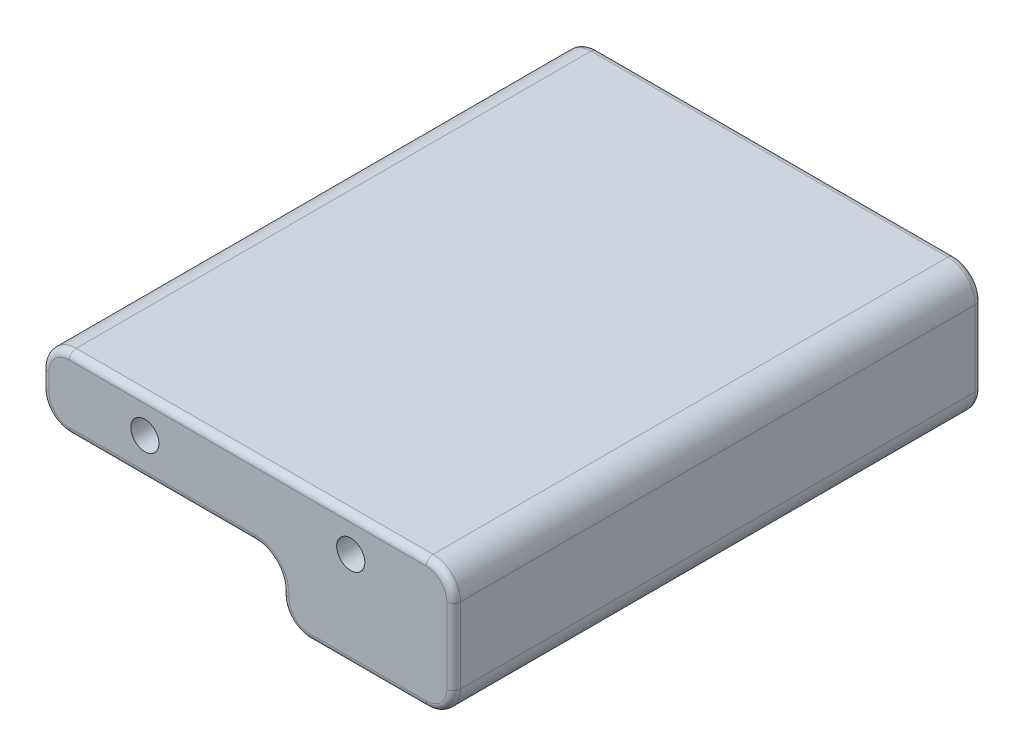
from build123d import *

# Parameters (mm, degrees)
SKETCH_1_W          = 60
SKETCH_1_H          = 10.5
SKETCH_1_R          = 1.55
EXTRUDE_1_DEPTH     = 77
SKETCH_2_W          = 25
SKETCH_2_H          = 77
EXTRUDE_2_DEPTH     = 8.5
FILLET_2_R          = 4
SKETCH_3_R          = 1.55
CUT_EXTRUDE_1_DEPTH = 8
SKETCH_4_R          = 2.05
CUT_EXTRUDE_2_DEPTH = 5
CUT_EXTRUDE_START   = -5
SKETCH_5_R          = 2.05
CUT_EXTRUDE_3_DEPTH = 5
FILLET_3_R          = 1
SKETCH_6_R          = 2.05
CUT_EXTRUDE_4_DEPTH = 5


with BuildPart() as part:
    # 草图1 → 凸台-拉伸1 (new body)
    with BuildSketch(Plane.XY):
        with Locations((30, 5.25)):
            Rectangle(SKETCH_1_W, SKETCH_1_H)
        with Locations((15, 5.5)):
            Circle(SKETCH_1_R, mode=Mode.SUBTRACT)
        with Locations((45, 5.5)):
            Circle(SKETCH_1_R, mode=Mode.SUBTRACT)
    extrude(amount=EXTRUDE_1_DEPTH)

    # 草图2 → 凸台-拉伸2 (add)
    with BuildSketch(Plane.XZ):
        with Locations((47.5, 38.5)):
            Rectangle(SKETCH_2_W, SKETCH_2_H)
    extrude(amount=EXTRUDE_2_DEPTH)

    # 圆角2
    fillet_2_edges = [part.edges().sort_by_distance(p)[0] for p in [
        (35, 0, 38.5),
        (60, -8.5, 38.5),
        (35, -8.5, 38.5),
        (0, 10.5, 38.5),
        (60, 10.5, 38.5),
        (0, 0, 38.5),
    ]]
    fillet(fillet_2_edges, radius=FILLET_2_R)

    # 草图3 → 切除-拉伸1 (cut)
    with BuildSketch(Plane.XZ):
        with Locations((11.15, 63.5)):
            Circle(SKETCH_3_R)
        with Locations((11.15, 13.5)):
            Circle(SKETCH_3_R)
        with Locations((25.15, 63.5)):
            Circle(SKETCH_3_R)
        with Locations((25.15, 13.5)):
            Circle(SKETCH_3_R)
    extrude(amount=-CUT_EXTRUDE_1_DEPTH, mode=Mode.SUBTRACT)

    # 草图4 → 切除-拉伸2 (cut)
    with BuildSketch(Plane(origin=(0, 0, 0), x_dir=(-1, 0, 0), z_dir=(0, 0, -1))):
        with Locations((-45, 5.5)):
            Circle(SKETCH_4_R)
        with Locations((-15, 5.5)):
            Circle(SKETCH_4_R)
    extrude(amount=-CUT_EXTRUDE_2_DEPTH, mode=Mode.SUBTRACT)

    # 草图5 → 切除-拉伸3 (cut)
    with BuildSketch(Plane.XY.offset(77).offset(CUT_EXTRUDE_START)):
        with Locations(Location((15, 5.5, 0), (0, 0, 180))):
            Circle(SKETCH_5_R)
        with Locations(Location((45, 5.5, 0), (0, 0, 180))):
            Circle(SKETCH_5_R)
    extrude(amount=CUT_EXTRUDE_3_DEPTH, mode=Mode.SUBTRACT)

    # 圆角3
    fillet_3_edges = [part.edges().sort_by_distance(p)[0] for p in [
        (47.5, -8.5, 77),
        (47.5, -8.5, 0),
        (0, 5.25, 0),
        (30, 10.5, 0),
        (60, 1, 0),
        (35, -4.25, 0),
        (17.5, 0, 0),
        (1.171572875, 9.328427125, 0),
        (1.171572875, 1.171572875, 0),
        (58.828427125, 9.328427125, 0),
        (58.828427125, -7.328427125, 0),
        (36.171572875, -7.328427125, 0),
        (35, -4.25, 77),
        (0, 5.25, 77),
        (17.5, 0, 77),
        (60, 1, 77),
        (30, 10.5, 77),
        (1.171572875, 9.328427125, 77),
        (1.171572875, 1.171572875, 77),
        (58.828427125, 9.328427125, 77),
        (58.828427125, -7.328427125, 77),
        (36.171572875, -7.328427125, 77),
        (33.828427125, -1.171572875, 0),
        (33.828427125, -1.171572875, 77),
    ]]
    fillet(fillet_3_edges, radius=FILLET_3_R)

    # 草图6 → 切除-拉伸4 (cut)
    with BuildSketch(Plane.XZ):
        with Locations((11.15, 63.5)):
            Circle(SKETCH_6_R)
        with Locations((25.15, 63.5)):
            Circle(SKETCH_6_R)
        with Locations((25.15, 13.5)):
            Circle(SKETCH_6_R)
        with Locations((11.15, 13.5)):
            Circle(SKETCH_6_R)
    extrude(amount=-CUT_EXTRUDE_4_DEPTH, mode=Mode.SUBTRACT)


solid = part.part
